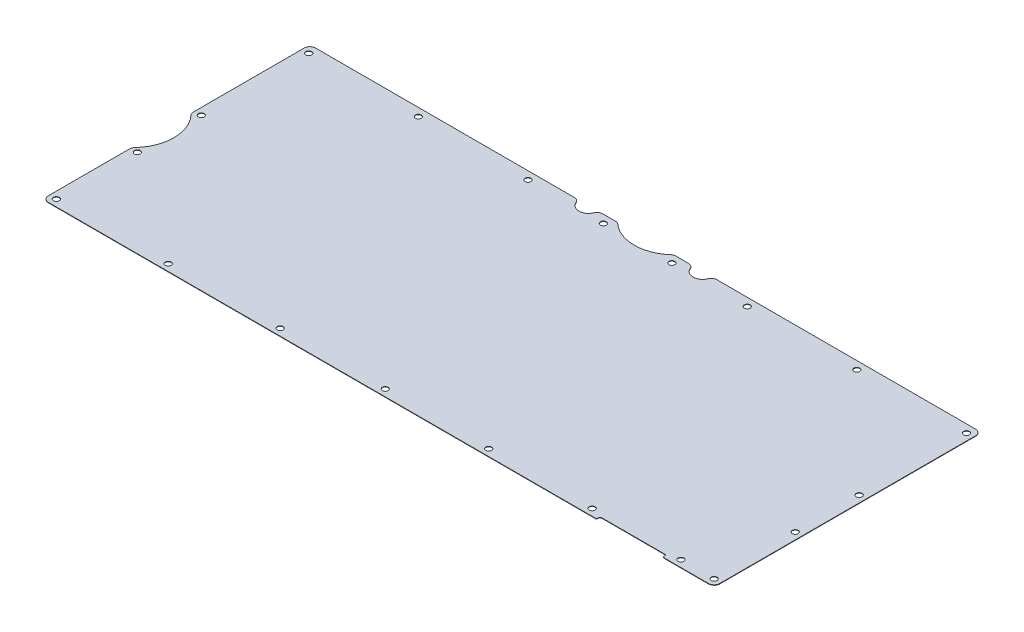
from build123d import *

# Parameters (mm, degrees)
SKETCH1_W                 = 373.38
SKETCH1_H                 = 149.225
BOSS_EXTRUDE1_DEPTH       = 0.254
F_4_CLEARANCE_HOLE2_D     = 3.2639
F_4_CLEARANCE_HOLE2_DEPTH = 0.762
F_4_CLEARANCE_HOLE2_TIP   = 0.980574487
CUT_EXTRUDE2_REACH        = 203.048
SKETCH7_R                 = 22.225
FILLET2_R                 = 3.175
F_4_CLEARANCE_HOLE3_D     = 3.2639
SKETCH10_R                = 5.334
CUT_EXTRUDE3_DEPTH        = 1.016
FILLET3_R                 = 3.175
SKETCH11_R                = 22.86
CUT_EXTRUDE4_DEPTH        = 202.047869355
FILLET4_R                 = 3.175
F_4_CLEARANCE_HOLE4_D     = 3.2639
SKETCH15_W                = 36.703
SKETCH15_H                = 2.6035
CUT_EXTRUDE5_DEPTH        = 202.047869355
F_4_CLEARANCE_HOLE5_D     = 3.2639
SKETCH20_W                = 373.38
SKETCH20_H                = 0.635
CUT_EXTRUDE6_DEPTH        = 202.047869355
FILLET6_R                 = 0.762
FILLET7_R                 = 3.175


with BuildPart() as part:
    # Sketch1 → Boss-Extrude1 (new body)
    with BuildSketch(Plane(origin=(0, 0, 0), x_dir=(1, 0, 0), z_dir=(0, 1, 0))):
        Rectangle(SKETCH1_W, SKETCH1_H)
    extrude(amount=BOSS_EXTRUDE1_DEPTH)

    # #4 Clearance Hole2
    with Locations(Plane(origin=(0, 0.254, 0), x_dir=(-1, 0, 0), z_dir=(0, 1, 0))):
        with Locations((121.92, -70.1675), (60.96, -70.1675), (0, -70.1675), (-60.96, -70.1675), (-121.92, -70.1675)):
            Hole(F_4_CLEARANCE_HOLE2_D / 2, depth=F_4_CLEARANCE_HOLE2_DEPTH)
            with Locations((0, 0, -(F_4_CLEARANCE_HOLE2_DEPTH + F_4_CLEARANCE_HOLE2_TIP / 2))):  # 118° drill point
                Cone(0, F_4_CLEARANCE_HOLE2_D / 2, F_4_CLEARANCE_HOLE2_TIP, mode=Mode.SUBTRACT)

    # Sketch7 → Cut-Extrude2 (cut, up to next)
    with BuildSketch(Plane(origin=(0, 0.254, 0), x_dir=(1, 0, 0), z_dir=(0, 1, 0)), mode=Mode.PRIVATE) as cut_extrude2_sk1:
        with Locations((0, 90.4875)):
            Circle(SKETCH7_R)
    cut_extrude2_tool1 = extrude(cut_extrude2_sk1.sketch, amount=-CUT_EXTRUDE2_REACH, mode=Mode.PRIVATE) & part.part
    add(cut_extrude2_tool1.solids().sort_by_distance((0, 0.254, -90.4875))[0], mode=Mode.SUBTRACT)

    # Fillet2
    fillet2_edges = [part.edges().sort_by_distance(p)[0] for p in [
        (15.554259867, 0.127, -74.6125),
        (-15.554259867, 0.127, -74.6125),
    ]]
    fillet(fillet2_edges, radius=FILLET2_R)

    # #4 Clearance Hole3 (through all)
    with Locations(Plane(origin=(0, 0.254, 0), x_dir=(-1, 0, 0), z_dir=(0, 1, 0))):
        with Locations((19.05, -70.1675), (-19.05, -70.1675)):
            Hole(F_4_CLEARANCE_HOLE3_D / 2)

    # Sketch10 → Cut-Extrude3 (cut)
    with BuildSketch(Plane(origin=(0, 0.254, 0), x_dir=(1, 0, 0), z_dir=(0, 1, 0))):
        with Locations((31.75, 74.6125)):
            Circle(SKETCH10_R)
        with Locations((-31.75, 74.6125)):
            Circle(SKETCH10_R)
    extrude(amount=-CUT_EXTRUDE3_DEPTH, mode=Mode.SUBTRACT)

    # Fillet3
    fillet3_edges = [part.edges().sort_by_distance(p)[0] for p in [
        (37.084, 0.127, -74.6125),
        (26.416, 0.127, -74.6125),
        (-26.416, 0.127, -74.6125),
        (-37.084, 0.127, -74.6125),
    ]]
    fillet(fillet3_edges, radius=FILLET3_R)

    # Sketch11 → Cut-Extrude4 (cut, through all)
    with BuildSketch(Plane(origin=(0, 0.254, 0), x_dir=(1, 0, 0), z_dir=(0, 1, 0))):
        with Locations((-202.565, -7.9375)):
            Circle(SKETCH11_R)
    extrude(amount=-CUT_EXTRUDE4_DEPTH, mode=Mode.SUBTRACT)

    # Fillet4
    fillet4_edges = [part.edges().sort_by_distance(p)[0] for p in [
        (-186.69, 0.127, -8.511328986),
        (-186.69, 0.127, 24.386328986),
        (-186.69, 0.127, -74.6125),
        (186.69, 0.127, -74.6125),
    ]]
    fillet(fillet4_edges, radius=FILLET4_R)

    # #4 Clearance Hole4 (through all)
    with Locations(Plane(origin=(0, 0.254, 0), x_dir=(-1, 0, 0), z_dir=(0, 1, 0))):
        with Locations((182.88, -70.1675), (182.88, -10.4775), (182.88, 25.0825), (182.88, 70.1675)):
            f_4_clearance_hole4 = Hole(F_4_CLEARANCE_HOLE4_D / 2)

    # Mirror1: #4 Clearance Hole4 across plane
    add(f_4_clearance_hole4.mirror(Plane(origin=(0, 0, 0), x_dir=(0, 0, 1), z_dir=(1, 0, 0))), mode=Mode.SUBTRACT)

    # Sketch15 → Cut-Extrude5 (cut, through all)
    with BuildSketch(Plane(origin=(0, 0.254, 0), x_dir=(1, 0, 0), z_dir=(0, 1, 0))):
        with Locations((139.7, -73.31075)):
            Rectangle(SKETCH15_W, SKETCH15_H)
    extrude(amount=-CUT_EXTRUDE5_DEPTH, mode=Mode.SUBTRACT)

    # #4 Clearance Hole5 (through all)
    with Locations(Plane(origin=(0, 0.254, 0), x_dir=(-1, 0, 0), z_dir=(0, 1, 0))):
        with Locations((-115.062, 70.1675), (-164.465, 70.1675), (0, 70.1675), (-57.531, 70.1675), (120.65, 70.1675), (58.42, 70.1675)):
            Hole(F_4_CLEARANCE_HOLE5_D / 2)

    # Sketch20 → Cut-Extrude6 (cut, through all)
    with BuildSketch(Plane(origin=(0, 0.254, 0), x_dir=(1, 0, 0), z_dir=(0, 1, 0))):
        with Locations((0, -74.295)):
            Rectangle(SKETCH20_W, SKETCH20_H)
    extrude(amount=-CUT_EXTRUDE6_DEPTH, mode=Mode.SUBTRACT)

    # Fillet6
    fillet6_edges = [part.edges().sort_by_distance(p)[0] for p in [
        (158.0515, 0.127, 72.009),
        (121.3485, 0.127, 72.009),
        (121.3485, 0.127, 73.9775),
        (158.0515, 0.127, 73.9775),
    ]]
    fillet(fillet6_edges, radius=FILLET6_R)

    # Fillet7
    fillet7_edges = [part.edges().sort_by_distance(p)[0] for p in [
        (-186.69, 0.127, 73.9775),
        (186.69, 0.127, 73.9775),
    ]]
    fillet(fillet7_edges, radius=FILLET7_R)


solid = part.part
